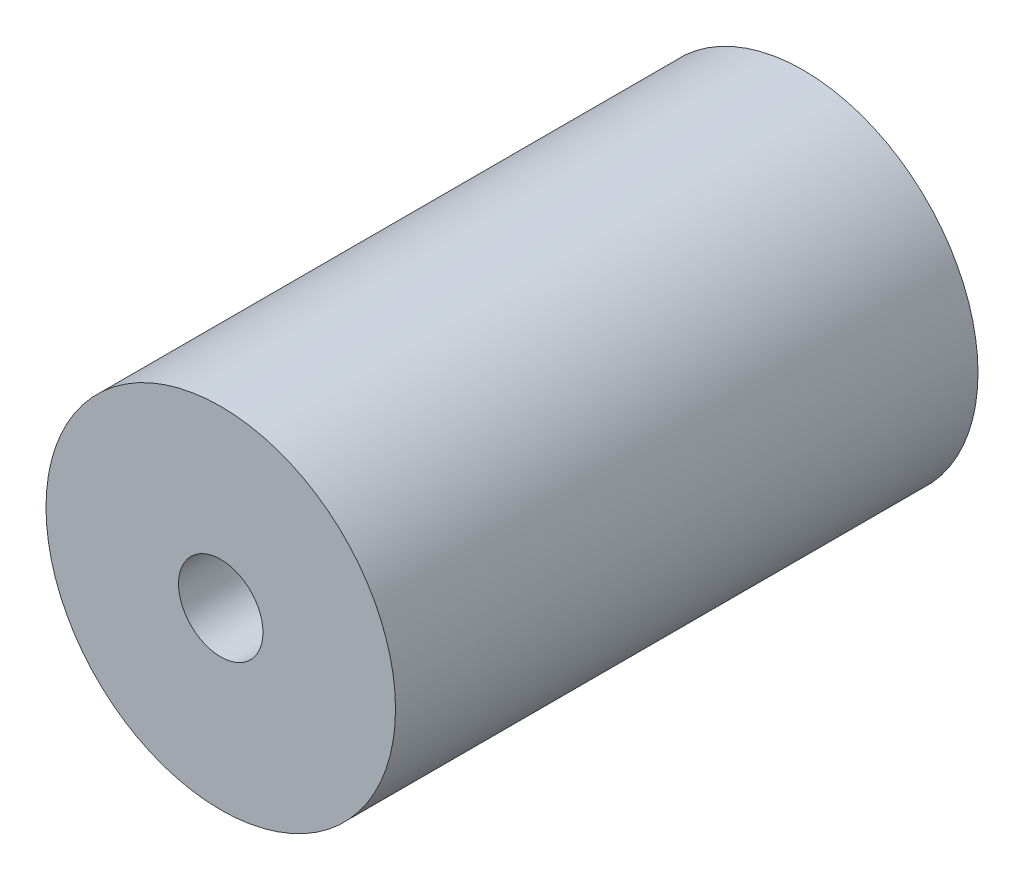
from build123d import *

# Parameters (mm, degrees)
SKETCH_1_R      = 6
SKETCH_1_R_2    = 1.45
EXTRUDE_1_DEPTH = 20


with BuildPart() as part:
    # 草图1 → 凸台-拉伸1 (new body)
    with BuildSketch(Plane.XY):
        Circle(SKETCH_1_R)
        Circle(SKETCH_1_R_2, mode=Mode.SUBTRACT)
    extrude(amount=EXTRUDE_1_DEPTH)


solid = part.part
